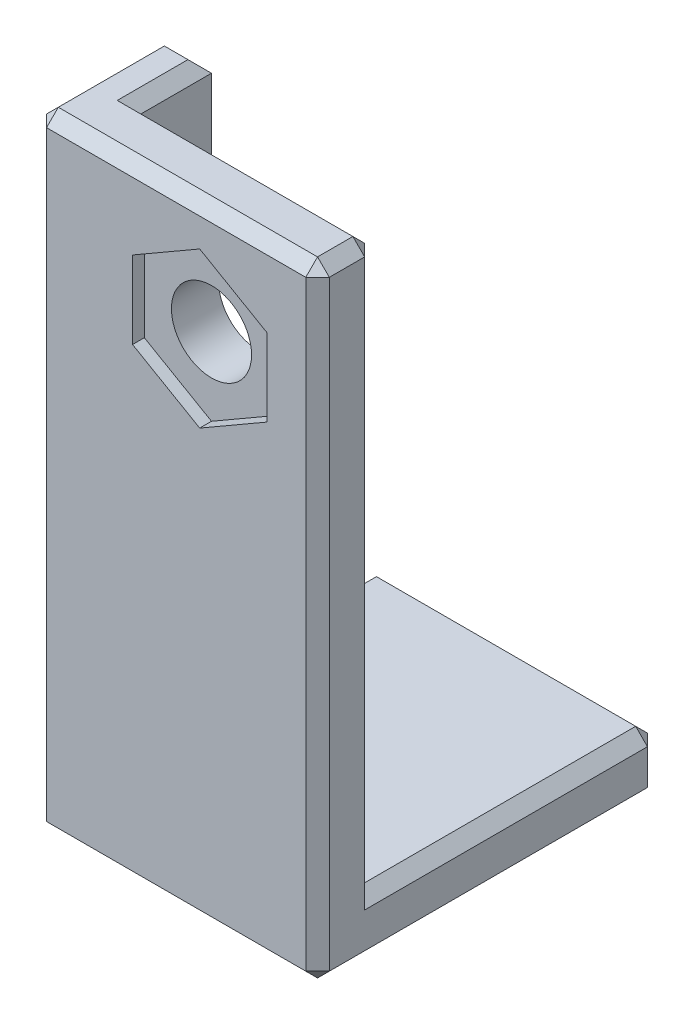
from build123d import *

# Parameters (mm, degrees)
SKETCH1_W           = 2.5
SKETCH1_H           = 24
SKETCH1_W_2         = 12
SKETCH1_H_2         = 2.5
BOSS_EXTRUDE1_DEPTH = 10
CUT_EXTRUDE1_DEPTH  = 10
CUT_EXTRUDE2_DEPTH  = 0.5
SKETCH5_W           = 3
SKETCH5_H           = 24
SKETCH5_W_2         = 9
SKETCH5_H_2         = 2.5
BOSS_EXTRUDE2_DEPTH = 2
CHAMFER1_SIZE       = 0.5


with BuildPart() as part:
    # Sketch1 → Boss-Extrude1 (new body)
    with BuildSketch(Plane(origin=(0, 0, 0), x_dir=(0, 0, -1), z_dir=(1, 0, 0))):
        with Locations((1.25, 14.5)):
            Rectangle(SKETCH1_W, SKETCH1_H)
        with Locations((8.5, 1.25)):
            Rectangle(SKETCH1_W_2, SKETCH1_H_2)
        with Locations((1.25, 1.25)):
            Rectangle(SKETCH1_W, SKETCH1_H_2)
    extrude(amount=BOSS_EXTRUDE1_DEPTH)

    # Sketch2 → Cut-Extrude1 (cut)
    with BuildSketch(Plane.XY):
        with BuildLine():
            ThreePointArc((6.7, 21.5), (6.202081528, 22.702081528), (5, 23.2))
            Line((5, 23.2), (5, 19.8))
            ThreePointArc((5, 19.8), (6.202081528, 20.297918472), (6.7, 21.5))
        make_face()
        with BuildLine():
            Line((5, 19.8), (5, 23.2))
            ThreePointArc((5, 23.2), (3.3, 21.5), (5, 19.8))
        make_face()
    extrude(amount=-CUT_EXTRUDE1_DEPTH, mode=Mode.SUBTRACT)

    # Sketch4 → Cut-Extrude2 (cut)
    with BuildSketch(Plane.XY):
        Polygon((5, 24.790896534), (2.15, 23.145448267), (2.15, 19.854551733), (5, 18.209103466), (7.85, 19.854551733), (7.85, 23.145448267), align=None)
    extrude(amount=-CUT_EXTRUDE2_DEPTH, mode=Mode.SUBTRACT)

    # Sketch5 → Boss-Extrude2 (add)
    with BuildSketch(Plane.ZY):
        with Locations((-4, 14.5)):
            Rectangle(SKETCH5_W, SKETCH5_H)
        Polygon((-5.5, 0), (0, 0), (0, 26.5), (-2.5, 26.5), (-2.5, 2.5), (-5.5, 2.5), align=None)
        with Locations((-10, 1.25)):
            Rectangle(SKETCH5_W_2, SKETCH5_H_2)
    extrude(amount=BOSS_EXTRUDE2_DEPTH)

    # Chamfer1
    chamfer1_edges = [part.edges().sort_by_distance(p)[0] for p in [
        (10, 0, -7.25),
        (4, 26.5, 0),
        (5, 26.5, -2.5),
        (4, 2.5, -14.5),
        (4, 0, -14.5),
        (4, 0, 0),
        (10, 1.25, -14.5),
        (10, 2.5, -8.5),
        (10, 14.5, -2.5),
        (10, 26.5, -1.25),
        (10, 13.25, 0),
        (-2, 14.5, -5.5),
        (-1, 26.5, -5.5),
        (0, 26.5, -4),
        (-2, 2.5, -10),
        (-2, 1.25, -14.5),
        (-2, 0, -7.25),
        (-2, 13.25, 0),
        (-2, 26.5, -2.75),
    ]]
    chamfer(chamfer1_edges, length=CHAMFER1_SIZE)


solid = part.part
